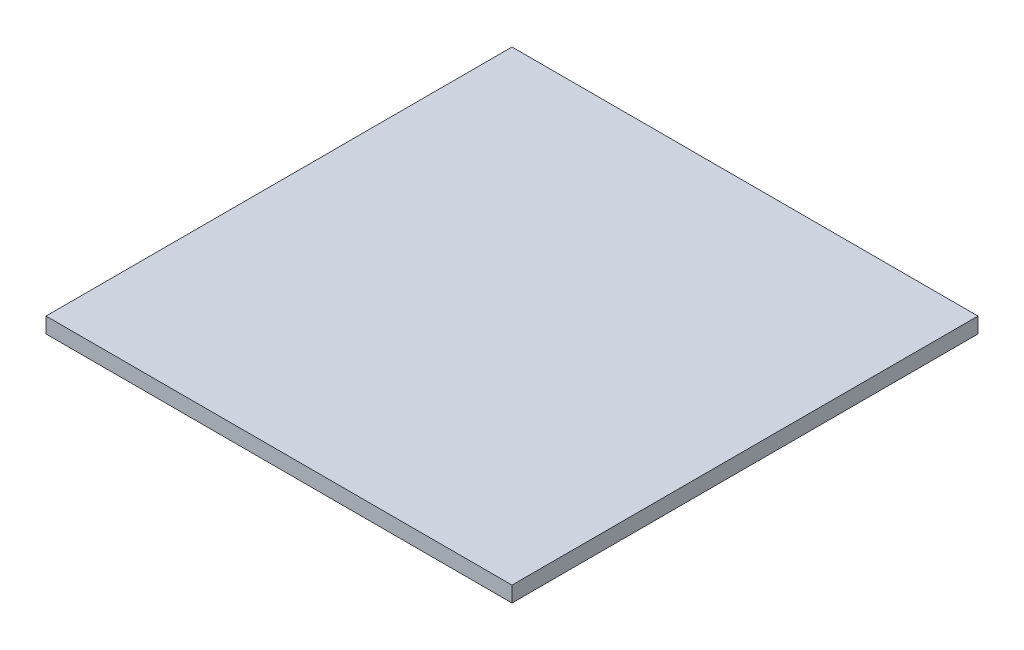
from build123d import *

# Parameters (mm, degrees)
SKETCH_1_W      = 300
SKETCH_1_H      = 300
EXTRUDE_1_DEPTH = 10


with BuildPart() as part:
    # 草图1 → 凸台-拉伸1 (new body)
    with BuildSketch(Plane(origin=(0, 0, 0), x_dir=(1, 0, 0), z_dir=(0, 1, 0))):
        Rectangle(SKETCH_1_W, SKETCH_1_H)
    extrude(amount=EXTRUDE_1_DEPTH)


solid = part.part
